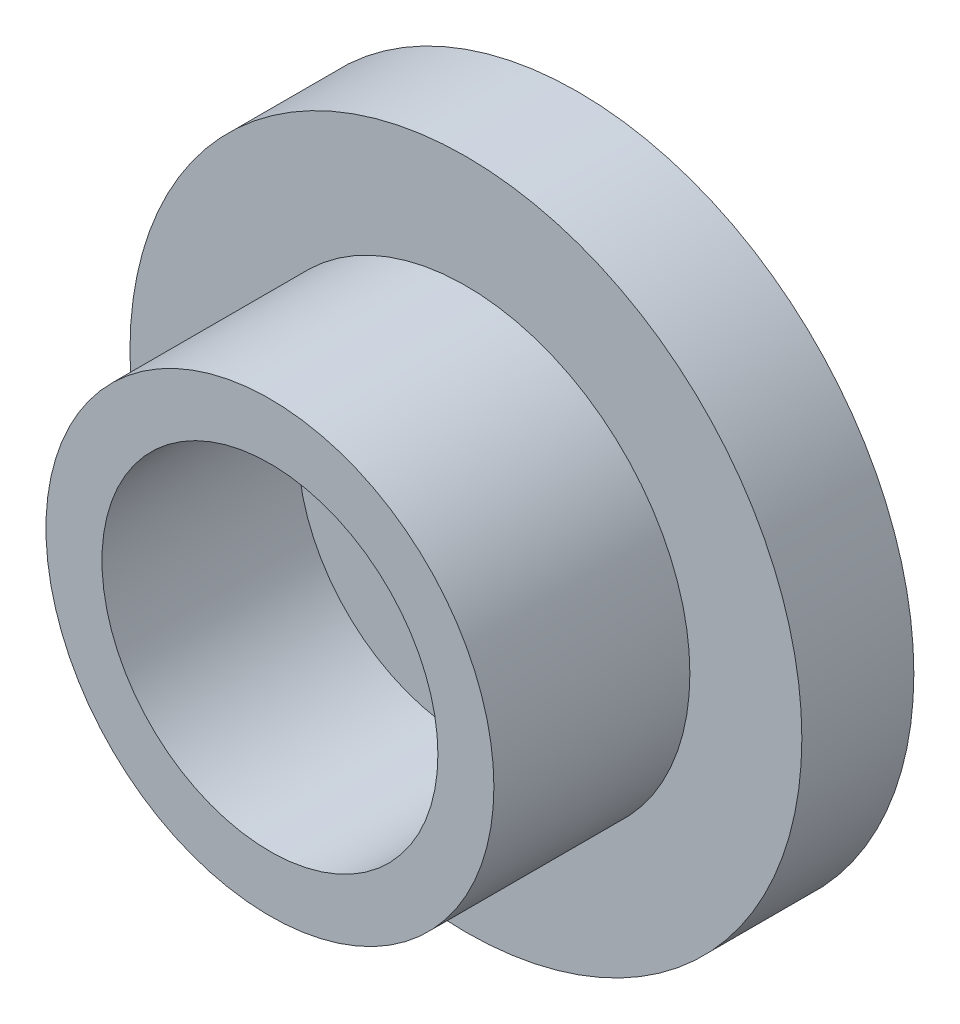
from build123d import *

# Parameters (mm, degrees)
SKETCH1_R           = 6
BOSS_EXTRUDE1_DEPTH = 2
SKETCH2_R           = 4
SKETCH2_R_2         = 3
BOSS_EXTRUDE2_DEPTH = 3.5


with BuildPart() as part:
    # Sketch1 → Boss-Extrude1 (new body)
    with BuildSketch(Plane.XY):
        Circle(SKETCH1_R)
    extrude(amount=BOSS_EXTRUDE1_DEPTH)

    # Sketch2 → Boss-Extrude2 (add)
    with BuildSketch(Plane.XY.offset(2)):
        Circle(SKETCH2_R)
        Circle(SKETCH2_R_2, mode=Mode.SUBTRACT)
    extrude(amount=BOSS_EXTRUDE2_DEPTH)


solid = part.part
